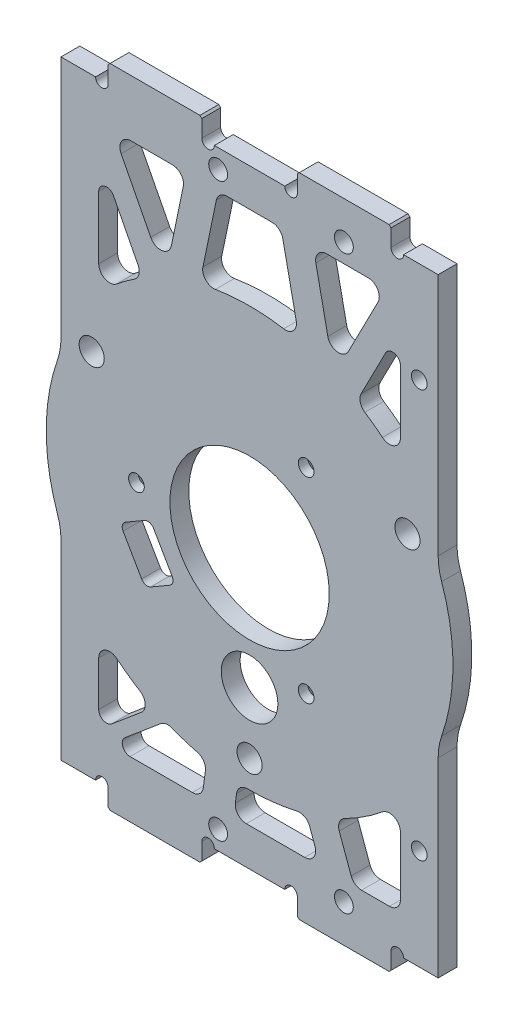
from build123d import *

# Parameters (mm, degrees)
SKETCH_1_W          = 60
SKETCH_1_H          = 88.5
SKETCH_1_R          = 2
EXTRUDE_1_DEPTH     = 3
SKETCH_2_R          = 12.675
CUT_EXTRUDE_1_DEPTH = 3
SKETCH_5_R          = 4.5
CUT_EXTRUDE_2_DEPTH = 10
EXTRUDE_2_DEPTH     = 3
SKETCH_7_W          = 60
SKETCH_7_H          = 8.4
EXTRUDE_3_DEPTH     = 3
CUT_EXTRUDE_3_DEPTH = 10
SKETCH_9_R          = 1.5
SKETCH_9_R_2        = 1.25
CUT_EXTRUDE_4_DEPTH = 62.867156068
SKETCH_10_W         = 14.9
SKETCH_10_H         = 3
EXTRUDE_4_DEPTH     = 3
SKETCH_11_R         = 1
CUT_EXTRUDE_5_DEPTH = 65.43946772
CHAMFER_1_SIZE      = 0.3
SKETCH_12_R         = 1.25
CUT_EXTRUDE_6_DEPTH = 65.43946772
FILLET_3_R          = 10
FILLET_4_R          = 1.75
FILLET_5_R          = 1.05
FILLET_6_R          = 1.25
CHAMFER_2_SIZE      = 1.5


with BuildPart() as part:
    # 草图1 → 凸台-拉伸1 (new body)
    with BuildSketch(Plane.XY):
        Rectangle(SKETCH_1_W, SKETCH_1_H)
        with Locations((25.11473671, 14.5)):
            Circle(SKETCH_1_R, mode=Mode.SUBTRACT)
        with Locations((0, -29)):
            Circle(SKETCH_1_R, mode=Mode.SUBTRACT)
        with Locations((-25.11473671, 14.5)):
            Circle(SKETCH_1_R, mode=Mode.SUBTRACT)
    extrude(amount=EXTRUDE_1_DEPTH)

    # 草图2 → 切除-拉伸1 (cut)
    with BuildSketch(Plane.XY.offset(3)):
        Circle(SKETCH_2_R)
    extrude(amount=-CUT_EXTRUDE_1_DEPTH, mode=Mode.SUBTRACT)

    # 草图5 → 切除-拉伸2 (cut)
    with BuildSketch(Plane.XY.offset(3)):
        with Locations((0, -19.25)):
            Circle(SKETCH_5_R)
        Polygon((-11.796598839, -10.967691454), (-15.796598839, -4.039488223), (-20.646341101, -6.839488223), (-16.646341101, -13.767691454), align=None)
    extrude(amount=-CUT_EXTRUDE_2_DEPTH, mode=Mode.SUBTRACT)

    # 草图6 → 凸台-拉伸2 (add)
    with BuildSketch(Plane.XY.offset(3)):
        with BuildLine():
            ThreePointArc((-30, 12.104647868), (-32.35, 0), (-30, -12.104647868))
            Line((-30, -12.104647868), (-30, 12.104647868))
        make_face()
        with BuildLine():
            Line((30, -12.104647868), (30, 12.104647868))
            ThreePointArc((30, 12.104647868), (32.35, 0), (30, -12.104647868))
        make_face()
    extrude(amount=-EXTRUDE_2_DEPTH)

    # 草图7 → 凸台-拉伸3 (add)
    with BuildSketch(Plane(origin=(0, 0, 0), x_dir=(-1, 0, 0), z_dir=(0, 0, -1))):
        with Locations((0, 48.45)):
            Rectangle(SKETCH_7_W, SKETCH_7_H)
    extrude(amount=-EXTRUDE_3_DEPTH)

    # 草图8 → 切除-拉伸3 (cut)
    with BuildSketch(Plane(origin=(0, 0, 0), x_dir=(-1, 0, 0), z_dir=(0, 0, -1))):
        with BuildLine():
            Line((-24, 42.278197597), (-24, 23.156478575))
            ThreePointArc((-24, 23.156478575), (-20.689565781, 26.156535852), (-17.007848271, 28.687202673))
            Line((-17.007848271, 28.687202673), (-24, 42.278197597))
        make_face()
        Polygon((-13.456964392, 30.52877694), (-10.106820911, 46.65), (-21.750841208, 46.65), align=None)
        with BuildLine():
            ThreePointArc((-7.964394001, 32.385041735), (0, 33.35), (7.964394001, 32.385041735))
            Line((7.964394001, 32.385041735), (5, 46.65))
            Line((5, 46.65), (-5, 46.65))
            Line((-5, 46.65), (-7.964394001, 32.385041735))
        make_face()
        Polygon((13.456964392, 30.52877694), (21.750841208, 46.65), (10.106820911, 46.65), align=None)
        with BuildLine():
            ThreePointArc((17.007848271, 28.687202673), (20.689565781, 26.156535852), (24, 23.156478575))
            Line((24, 23.156478575), (24, 42.278197597))
            Line((24, 42.278197597), (17.007848271, 28.687202673))
        make_face()
        with BuildLine():
            Line((-11.261417029, -38.25), (2.514135631, -38.25))
            Line((2.514135631, -38.25), (1.862188411, -33.297969222))
            ThreePointArc((1.862188411, -33.297969222), (-3.630710276, -33.15177888), (-9.025046714, -32.105623056))
            Line((-9.025046714, -32.105623056), (-11.261417029, -38.25))
        make_face()
        with BuildLine():
            ThreePointArc((-13.723509818, -30.395522339), (-19.205903699, -27.264551401), (-24, -23.156478575))
            Line((-24, -23.156478575), (-24, -38.25))
            Line((-24, -38.25), (-16.582305892, -38.25))
            Line((-16.582305892, -38.25), (-13.723509818, -30.395522339))
        make_face()
        with BuildLine():
            Line((6.819412718, -32.645338261), (7.557280434, -38.25))
            Line((7.557280434, -38.25), (22.444276173, -38.25))
            Line((22.444276173, -38.25), (13.304838766, -30.581101442))
            ThreePointArc((13.304838766, -30.581101442), (10.114921792, -31.779094656), (6.819412718, -32.645338261))
        make_face()
        with BuildLine():
            Line((24, -36.944592711), (24, -23.156478575))
            ThreePointArc((24, -23.156478575), (19.911359511, -26.753696239), (15.291790802, -29.637537584))
            Line((15.291790802, -29.637537584), (24, -36.944592711))
        make_face()
    extrude(amount=-CUT_EXTRUDE_3_DEPTH, mode=Mode.SUBTRACT)

    # 草图9 → 切除-拉伸4 (cut, through all)
    with BuildSketch(Plane(origin=(0, 0, 0), x_dir=(-1, 0, 0), z_dir=(0, 0, -1))):
        with Locations((5, 49.65)):
            Circle(SKETCH_9_R)
        with Locations((-15, 49.65)):
            Circle(SKETCH_9_R)
        with Locations(Location((5, -41.25, 0), (0, 0, 180))):
            Circle(SKETCH_9_R)
        with Locations(Location((-15, -41.25, 0), (0, 0, 180))):
            Circle(SKETCH_9_R)
        with Locations((-27, -28.25)):
            Circle(SKETCH_9_R_2)
        with Locations(Location((-27, 36.65, 0), (0, 0, 180))):
            Circle(SKETCH_9_R_2)
    extrude(amount=-CUT_EXTRUDE_4_DEPTH, mode=Mode.SUBTRACT)

    # 草图10 → 凸台-拉伸4 (add)
    with BuildSketch(Plane(origin=(0, 0, 0), x_dir=(-1, 0, 0), z_dir=(0, 0, -1))):
        with Locations((-15.05, 54.15)):
            Rectangle(SKETCH_10_W, SKETCH_10_H)
        with Locations((15.05, 54.15)):
            Rectangle(SKETCH_10_W, SKETCH_10_H)
        with Locations((15.05, -45.75)):
            Rectangle(SKETCH_10_W, SKETCH_10_H)
        with Locations((-15.05, -45.75)):
            Rectangle(SKETCH_10_W, SKETCH_10_H)
    extrude(amount=-EXTRUDE_4_DEPTH)

    # 草图11 → 切除-拉伸5 (cut, through all)
    with BuildSketch(Plane(origin=(0, 0, 0), x_dir=(-1, 0, 0), z_dir=(0, 0, -1))):
        with Locations((-23.5, 52.65)):
            Circle(SKETCH_11_R)
        with Locations((-6.6, 52.65)):
            Circle(SKETCH_11_R)
        with Locations((6.6, 52.65)):
            Circle(SKETCH_11_R)
        with Locations((23.5, 52.65)):
            Circle(SKETCH_11_R)
        with Locations((23.5, -44.25)):
            Circle(SKETCH_11_R)
        with Locations((6.6, -44.25)):
            Circle(SKETCH_11_R)
        with Locations((-6.6, -44.25)):
            Circle(SKETCH_11_R)
        with Locations((-23.5, -44.25)):
            Circle(SKETCH_11_R)
    extrude(amount=-CUT_EXTRUDE_5_DEPTH, mode=Mode.SUBTRACT)

    # 倒角1
    chamfer_1_edges = [part.edges().sort_by_distance(p)[0] for p in [
        (7.6, 55.65, 1.5),
        (22.5, 55.65, 1.5),
        (-7.6, 55.65, 1.5),
        (-22.5, 55.65, 1.5),
        (-7.6, -47.25, 1.5),
        (-22.5, -47.25, 1.5),
        (7.6, -47.25, 1.5),
        (22.5, -47.25, 1.5),
    ]]
    chamfer(chamfer_1_edges, length=CHAMFER_1_SIZE)

    # 草图12 → 切除-拉伸6 (cut, through all)
    with BuildSketch(Plane(origin=(0, 0, 0), x_dir=(-1, 0, 0), z_dir=(0, 0, -1))):
        with Locations((-9, 15.588457268)):
            Circle(SKETCH_12_R)
        with Locations((18, 0)):
            Circle(SKETCH_12_R)
        with Locations((-9, -15.588457268)):
            Circle(SKETCH_12_R)
    extrude(amount=-CUT_EXTRUDE_6_DEPTH, mode=Mode.SUBTRACT)

    # 圆角3
    fillet_3_edges = [part.edges().sort_by_distance(p)[0] for p in [
        (-30, 12.104647868, 1.5),
        (-30, -12.104647868, 1.5),
        (30, -12.104647868, 1.5),
        (30, 12.104647868, 1.5),
    ]]
    fillet(fillet_3_edges, radius=FILLET_3_R)

    # 圆角4
    fillet_4_edges = [part.edges().sort_by_distance(p)[0] for p in [
        (-6.819412718, -32.645338261, 1.5),
        (-13.304838766, -30.581101442, 1.5),
        (-7.557280434, -38.25, 1.5),
        (-15.291790802, -29.637537584, 1.5),
        (-24, -23.156478575, 1.5),
        (24, -23.156478575, 1.5),
        (13.723509818, -30.395522339, 1.5),
        (16.582305892, -38.25, 1.5),
        (24, -38.25, 1.5),
        (9.025046714, -32.105623056, 1.5),
        (-1.862188411, -33.297969222, 1.5),
        (-2.514135631, -38.25, 1.5),
        (11.261417029, -38.25, 1.5),
        (-10.106820911, 46.65, 1.5),
        (-21.750841208, 46.65, 1.5),
        (-13.456964392, 30.52877694, 1.5),
        (-24, 23.156478575, 1.5),
        (-17.007848271, 28.687202673, 1.5),
        (-7.964394001, 32.385041735, 1.5),
        (7.964394001, 32.385041735, 1.5),
        (5, 46.65, 1.5),
        (-5, 46.65, 1.5),
        (10.106820911, 46.65, 1.5),
        (13.456964392, 30.52877694, 1.5),
        (21.750841208, 46.65, 1.5),
        (17.007848271, 28.687202673, 1.5),
        (24, 23.156478575, 1.5),
    ]]
    fillet(fillet_4_edges, radius=FILLET_4_R)

    # 圆角5
    fillet_5_edges = [part.edges().sort_by_distance(p)[0] for p in [
        (-16.646341101, -13.767691454, 1.5),
        (-20.646341101, -6.839488223, 1.5),
        (-15.796598839, -4.039488223, 1.5),
        (-11.796598839, -10.967691454, 1.5),
    ]]
    fillet(fillet_5_edges, radius=FILLET_5_R)

    # 圆角6
    fillet_6_edges = [part.edges().sort_by_distance(p)[0] for p in [
        (-22.444276173, -38.25, 1.5),
        (-24, -36.944592711, 1.5),
        (-24, 42.278197597, 1.5),
        (24, 42.278197597, 1.5),
    ]]
    fillet(fillet_6_edges, radius=FILLET_6_R)

    # 倒角2
    chamfer_2_edges = [part.edges().sort_by_distance(p)[0] for p in [
        (10.25, 15.588457268, 0),
        (-16.75, 0, 0),
        (10.25, -15.588457268, 0),
    ]]
    chamfer(chamfer_2_edges, length=CHAMFER_2_SIZE)


solid = part.part
